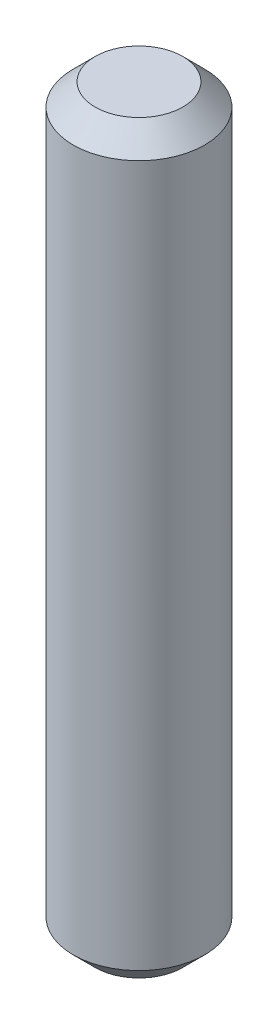
from build123d import *

# Parameters (mm, degrees)
SKETCH1_W     = 6
SKETCH1_H     = 68
CHAMFER1_SIZE = 2


with BuildPart() as part:
    # Sketch1 → Revolve1 (revolve)
    with BuildSketch(Plane.XY, mode=Mode.PRIVATE) as revolve1_sk:
        with Locations((3, -0.709224894)):
            Rectangle(SKETCH1_W, SKETCH1_H)
    revolve(revolve1_sk.sketch.rotate(Axis((0, 37.211252243, 0), (0, -1, 0)), 90), axis=Axis((0, 37.211252243, 0), (0, -1, 0)))

    # Chamfer1
    chamfer1_edges = [part.edges().sort_by_distance(p)[0] for p in [
        (0, -34.709224894, -6),
        (0, 33.290775106, -6),
    ]]
    chamfer(chamfer1_edges, length=CHAMFER1_SIZE)


solid = part.part
